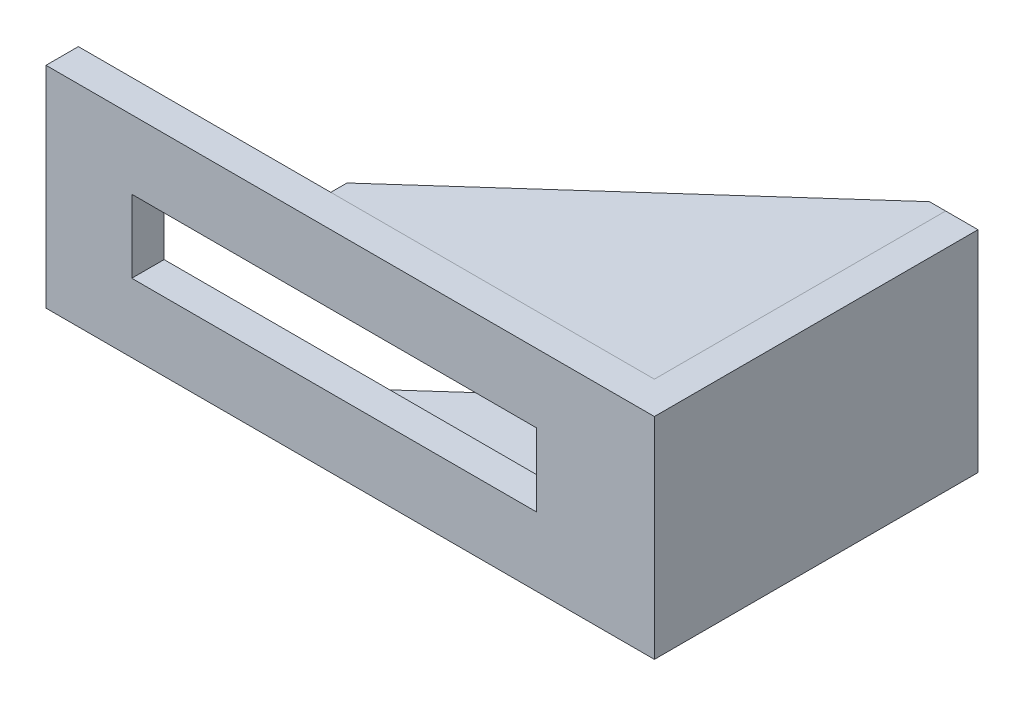
from build123d import *

# Parameters (mm, degrees)
SKETCH_1_W          = 356
SKETCH_1_H          = 130
EXTRUDE_1_DEPTH     = 20
SKETCH_2_W          = 200
SKETCH_2_H          = 130
EXTRUDE_2_DEPTH     = 20
EXTRUDE_3_DEPTH     = 20
SKETCH_4_W          = 250
SKETCH_4_H          = 45
CUT_EXTRUDE_1_DEPTH = 289.840786594


with BuildPart() as part:
    # 草图1 → 凸台-拉伸1 (new body)
    with BuildSketch(Plane.XY):
        Rectangle(SKETCH_1_W, SKETCH_1_H)
    extrude(amount=EXTRUDE_1_DEPTH)

    # 草图2 → 凸台-拉伸2 (add)
    with BuildSketch(Plane(origin=(178, 0, 0), x_dir=(0, 0, -1), z_dir=(1, 0, 0))):
        with Locations((80, 0)):
            Rectangle(SKETCH_2_W, SKETCH_2_H)
    extrude(amount=EXTRUDE_2_DEPTH)

    # 草图4 → 切除-拉伸1 (cut, through all)
    with BuildSketch(Plane.XY.offset(20)):
        Rectangle(SKETCH_4_W, SKETCH_4_H)
    extrude(amount=-CUT_EXTRUDE_1_DEPTH, mode=Mode.SUBTRACT)


with BuildPart() as body_2:
    # 草图3 → 凸台-拉伸3 (new body)
    with BuildSketch(Plane.XZ.offset(65)):
        Polygon((178, -180), (168, -180), (-22, -10), (-22, 0), (178, 0), align=None)
    extrude(amount=-EXTRUDE_3_DEPTH)


with BuildPart() as body_3:
    # 镜向2: mirrored copy
    add(body_2.part.mirror(Plane.ZX))


solid = Compound([part.part, body_2.part, body_3.part])
